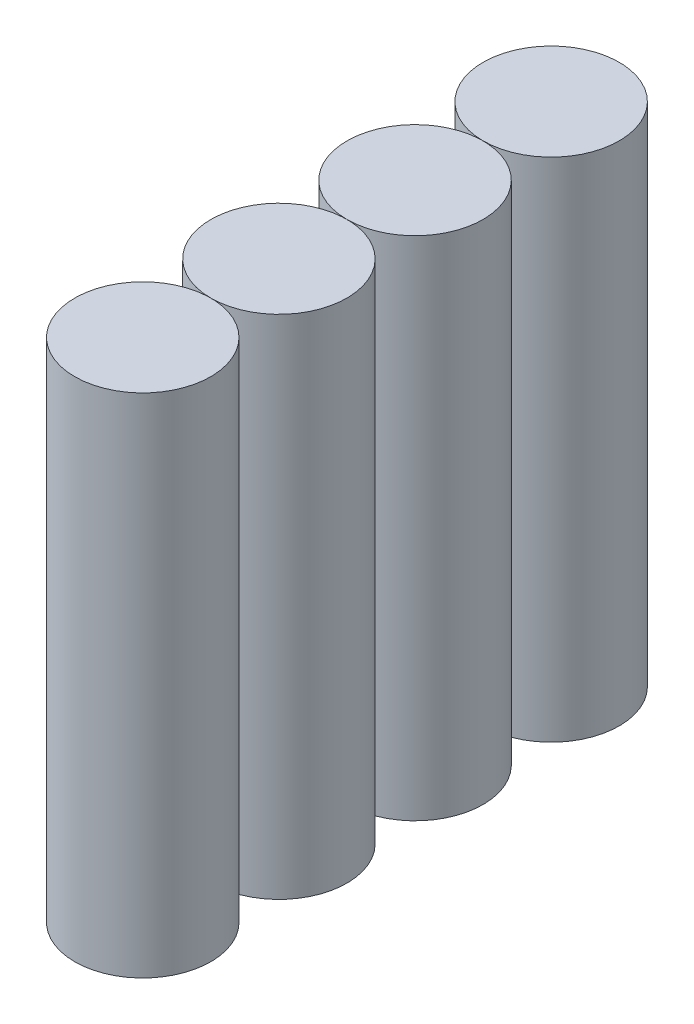
from build123d import *

# Parameters (mm, degrees)
SKETCH1_R             = 9
BOSS_EXTRUDE1_DEPTH   = 67
BOSS_EXTRUDE1_2_DEPTH = 67
BOSS_EXTRUDE1_3_DEPTH = 67
BOSS_EXTRUDE1_4_DEPTH = 67


with BuildPart() as part:
    # Sketch1 → Boss-Extrude1 (new body)
    with BuildSketch(Plane(origin=(0, 0, 0), x_dir=(1, 0, 0), z_dir=(0, 1, 0))):
        with Locations((-16.368168457, -64.565274904)):
            Circle(SKETCH1_R)
    extrude(amount=-BOSS_EXTRUDE1_DEPTH)


with BuildPart() as body_2:
    # Sketch1 → Boss-Extrude1 2 (new body)
    with BuildSketch(Plane(origin=(0, 0, 0), x_dir=(1, 0, 0), z_dir=(0, 1, 0))):
        with Locations((-16.368168457, -46.565274904)):
            Circle(SKETCH1_R)
    extrude(amount=-BOSS_EXTRUDE1_2_DEPTH)


with BuildPart() as body_3:
    # Sketch1 → Boss-Extrude1 3 (new body)
    with BuildSketch(Plane(origin=(0, 0, 0), x_dir=(1, 0, 0), z_dir=(0, 1, 0))):
        with Locations((-16.368168457, -28.565274904)):
            Circle(SKETCH1_R)
    extrude(amount=-BOSS_EXTRUDE1_3_DEPTH)


with BuildPart() as body_4:
    # Sketch1 → Boss-Extrude1 4 (new body)
    with BuildSketch(Plane(origin=(0, 0, 0), x_dir=(1, 0, 0), z_dir=(0, 1, 0))):
        with Locations((-16.368168457, -10.565274904)):
            Circle(SKETCH1_R)
    extrude(amount=-BOSS_EXTRUDE1_4_DEPTH)


solid = Compound([part.part, body_2.part, body_3.part, body_4.part])
